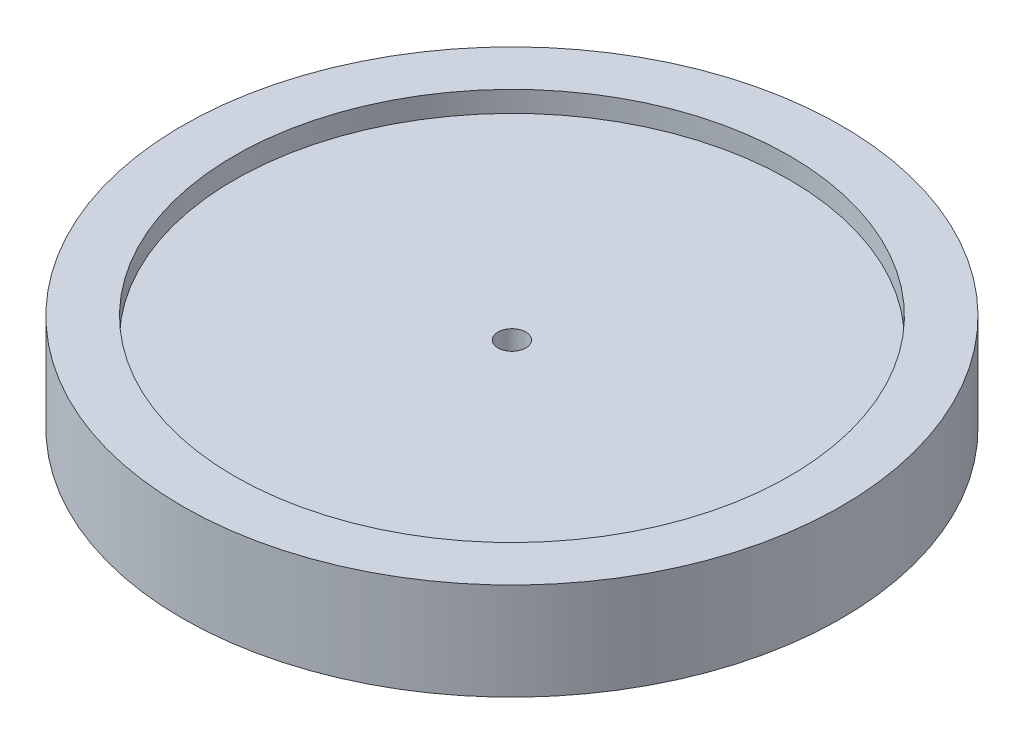
from build123d import *
from build123d.topology import SkipClean

# Parameters (mm, degrees)
SKETCH_1_R          = 47.5
SKETCH_1_R_2        = 2
EXTRUDE_1_DEPTH     = 14
EXTRUDE_START       = 5.2
SKETCH_2_R          = 9
SKETCH_2_R_2        = 2
EXTRUDE_2_DEPTH     = 5.2
SKETCH_4_R          = 40
SKETCH_4_R_2        = 9
CUT_EXTRUDE_3_DEPTH = 3
CUT_EXTRUDE_START   = -3
SKETCH_3_R          = 40
CUT_EXTRUDE_4_DEPTH = 3


with BuildPart() as part:
    # 草图1 → 凸台-拉伸1 (new body)
    with BuildSketch(Plane(origin=(0, 0, 0), x_dir=(1, 0, 0), z_dir=(0, 1, 0))):
        with Locations(Location((0, 0, 0), (0, 0, 270))):
            Circle(SKETCH_1_R)
        with Locations(Location((0, 0, 0), (0, 0, 270))):
            Circle(SKETCH_1_R_2, mode=Mode.SUBTRACT)
    extrude(amount=EXTRUDE_1_DEPTH)

    # 草图2 → 凸台-拉伸2 (add)
    with SkipClean():  # the faces are left unmerged after this step: merging them gives an invalid solid
        with BuildSketch(Plane(origin=(0, 0, 0), x_dir=(-1, 0, 0), z_dir=(0, -1, 0)).offset(EXTRUDE_START)):
            with Locations(Location((0, 0, 0), (0, 0, 270))):
                Circle(SKETCH_2_R)
            with Locations(Location((0, 0, 0), (0, 0, 90))):
                Circle(SKETCH_2_R_2, mode=Mode.SUBTRACT)
        extrude(amount=-EXTRUDE_2_DEPTH)

    # 草图4 → 切除-拉伸3 (cut)
    with SkipClean():  # the faces are left unmerged after this step: merging them gives an invalid solid
        with BuildSketch(Plane.XZ):
            with Locations(Location((0, 0, 0), (0, 0, 270))):
                Circle(SKETCH_4_R)
            with Locations(Location((0, 0, 0), (0, 0, 270))):
                Circle(SKETCH_4_R_2, mode=Mode.SUBTRACT)
        extrude(amount=-CUT_EXTRUDE_3_DEPTH, mode=Mode.SUBTRACT)

    # 草图3 → 切除-拉伸4 (cut)
    with BuildSketch(Plane(origin=(0, 14, 0), x_dir=(1, 0, 0), z_dir=(0, 1, 0)).offset(CUT_EXTRUDE_START)):
        with Locations(Location((0, 0, 0), (0, 0, 90))):
            Circle(SKETCH_3_R)
    extrude(amount=CUT_EXTRUDE_4_DEPTH, mode=Mode.SUBTRACT)


solid = part.part
